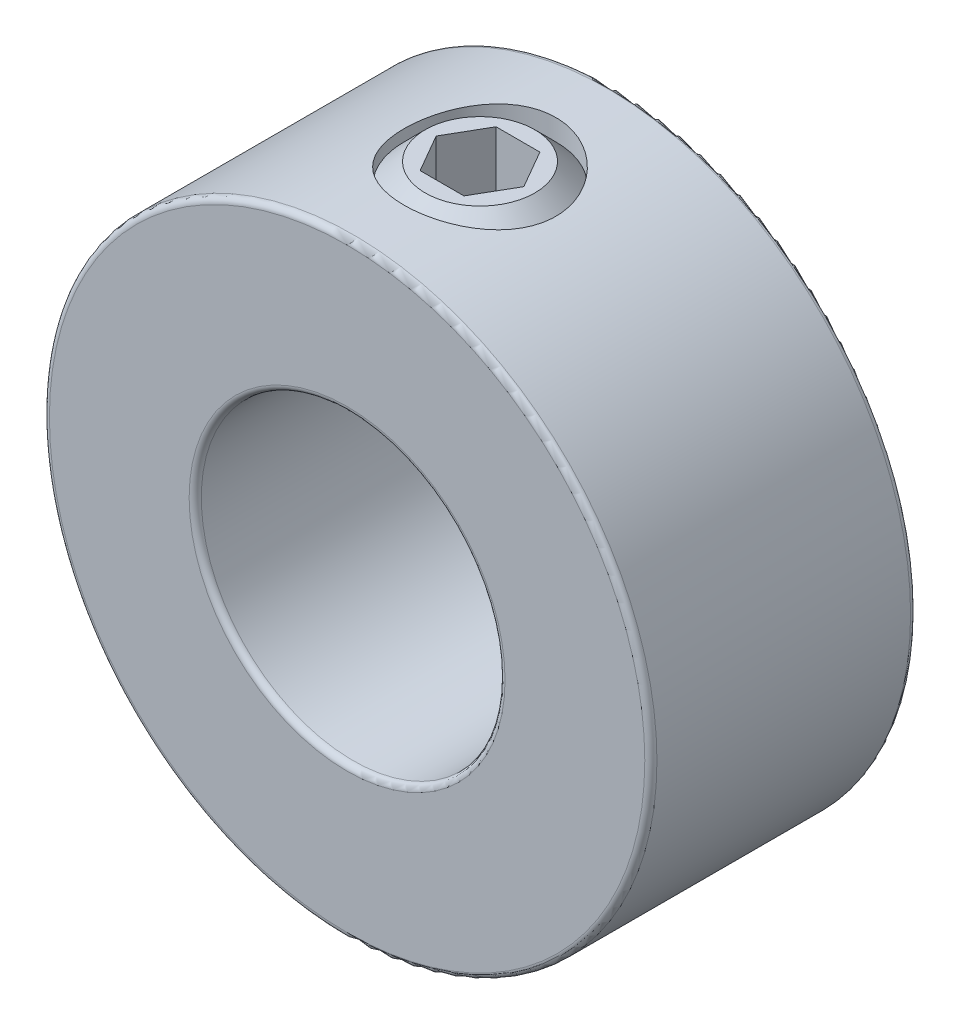
from build123d import *

# Parameters (mm, degrees)
SKETCH1_R               = 12.7
SKETCH1_R_2             = 6.35
EXTRUDE1_DEPTH          = 11.1125
CUT_EXTRUDE1_REACH      = 32.495
CUT_EXTRUDE1_END_RADIUS = 6.35
SKETCH2_R               = 3.175
CUT_EXTRUDE2_DEPTH      = 2.54
FILLET1_R               = 0.254


with BuildPart() as part:
    # Sketch1 → Extrude1 (new body)
    with BuildSketch(Plane.XY):
        Circle(SKETCH1_R)
        Circle(SKETCH1_R_2, mode=Mode.SUBTRACT)
    extrude(amount=EXTRUDE1_DEPTH)

    # Cut-Extrude1: up to this cylinder (the profile starts outside it)
    cut_extrude1_end = Plane(origin=(0, 0, 5.55625), z_dir=(0, 0, -1)) * Cylinder(CUT_EXTRUDE1_END_RADIUS, 78.69, mode=Mode.PRIVATE)
    # Sketch2 → Cut-Extrude1 (cut, up to the surface)
    with BuildSketch(Plane(origin=(0, 12.7, 0), x_dir=(-1, 0, 0), z_dir=(0, 1, 0)), mode=Mode.PRIVATE) as cut_extrude1_sk1:
        with Locations(Location((0, 5.55625, 0), (0, 0, 90))):
            Circle(SKETCH2_R)
    cut_extrude1_tool1 = extrude(cut_extrude1_sk1.sketch, amount=-CUT_EXTRUDE1_REACH, mode=Mode.PRIVATE) - cut_extrude1_end
    add(cut_extrude1_tool1.solids().sort_by_distance((0, 12.7, 5.55625))[0], mode=Mode.SUBTRACT)

    # Fillet1
    fillet1_edges = [part.edges().sort_by_distance(p)[0] for p in [
        (-12.7, 0, 0),
        (-12.7, 0, 11.1125),
        (-6.35, 0, 0),
        (-6.35, 0, 11.1125),
    ]]
    fillet(fillet1_edges, radius=FILLET1_R)


with BuildPart() as body_2:
    # Sketch3 → Revolve1 (revolve)
    with BuildSketch(Plane.XY.offset(5.55625), mode=Mode.PRIVATE) as revolve1_sk:
        Polygon((-2.291358881, 12.7), (-3.175, 11.816358881), (-3.175, 7.233641119), (-2.291358881, 6.35), (-0.79375, 6.35), (0, 7.724815329), (0, 12.7), align=None)
    revolve(revolve1_sk.sketch.rotate(Axis((0, 7.724815329, 5.55625), (0, 1, 0)), 180), axis=Axis((0, 7.724815329, 5.55625), (0, 1, 0)))

    # Sketch4 → Cut-Extrude2 (cut)
    with BuildSketch(Plane(origin=(0, 12.7, 0), x_dir=(0, 0, -1), z_dir=(0, 1, 0))):
        Polygon((-5.55625, 1.833087105), (-7.14375, 0.916543552), (-7.14375, -0.916543552), (-5.55625, -1.833087105), (-3.96875, -0.916543552), (-3.96875, 0.916543552), align=None)
    extrude(amount=-CUT_EXTRUDE2_DEPTH, mode=Mode.SUBTRACT)


solid = Compound([part.part, body_2.part])
